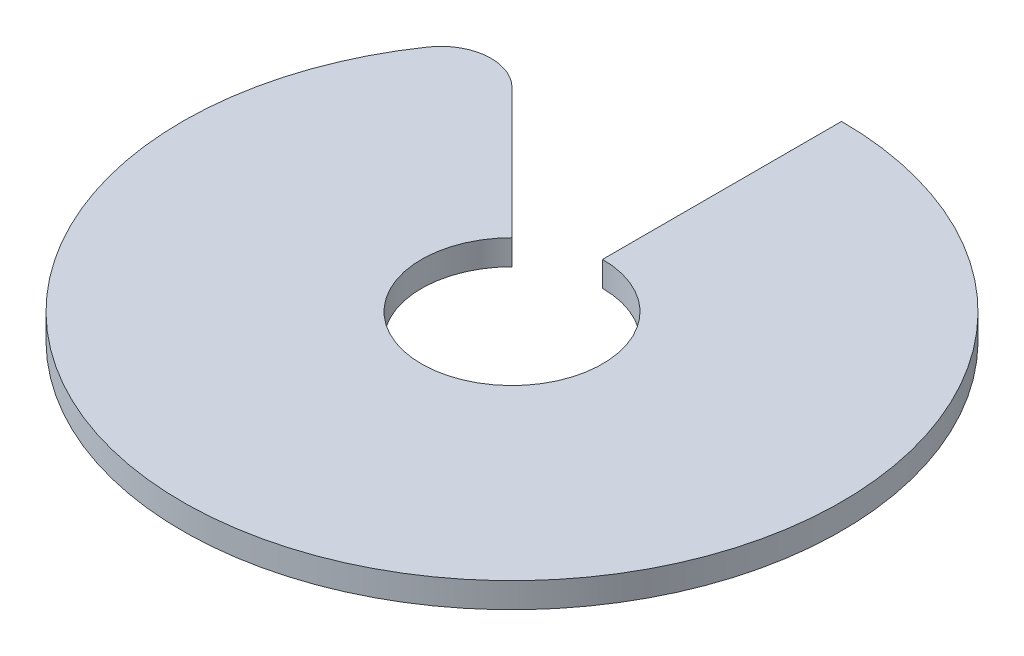
from build123d import *

# Parameters (mm, degrees)
EXTRUDE_1_DEPTH = 5
FILLET_1_R      = 10


with BuildPart() as part:
    # Эскиз1 → Бобышка-Вытянуть1 (new body)
    with BuildSketch(Plane(origin=(0, 0, 0), x_dir=(1, 0, 0), z_dir=(0, 1, 0))):
        with BuildLine():
            Line((-12.727922061, 12.727922061), (-46.315494168, 46.315494168))
            ThreePointArc((-46.315494168, 46.315494168), (25.06576482, -60.514109379), (0, 65.5))
            Line((0, 65.5), (0, 18))
            ThreePointArc((0, 18), (6.888301783, -16.629831585), (-12.727922061, 12.727922061))
        make_face()
    extrude(amount=EXTRUDE_1_DEPTH)

    # Скругление1
    fillet_1_edges = [part.edges().sort_by_distance(p)[0] for p in [
        (-46.315494168, 2.5, -46.315494168),
    ]]
    fillet(fillet_1_edges, radius=FILLET_1_R)


solid = part.part
